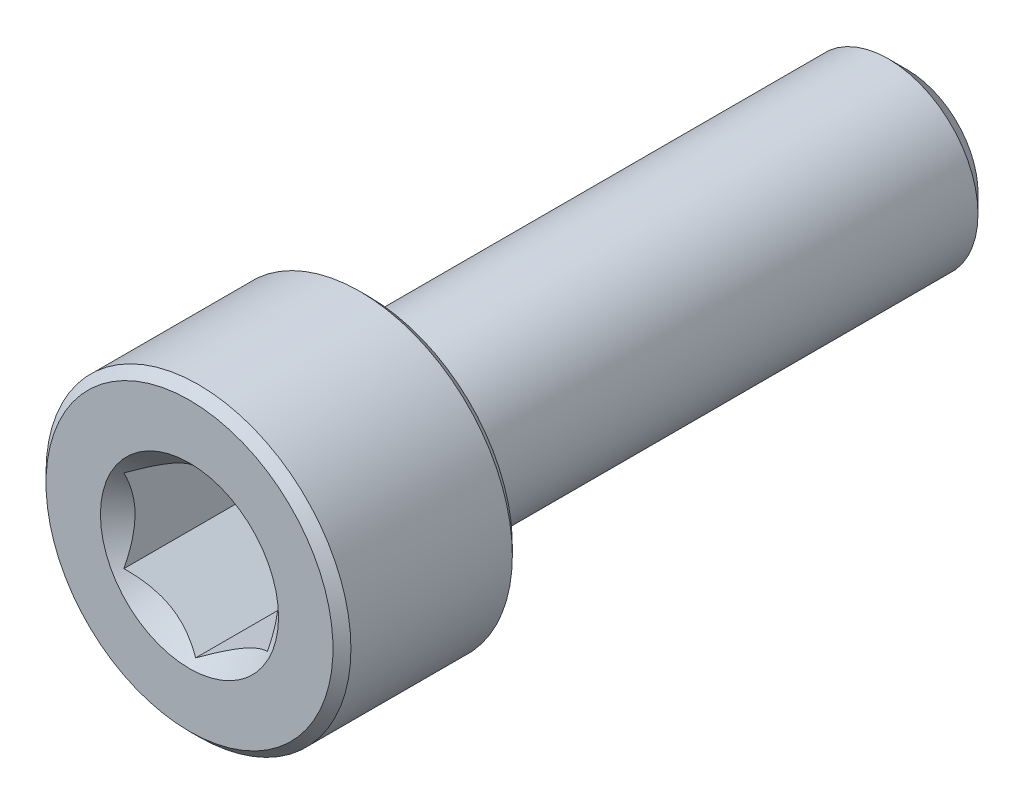
from build123d import *

# Parameters (mm, degrees)
CUT_EXTRUDE1_DEPTH = 4


with BuildPart() as part:
    # Sketch2 → Revolve1 (revolve)
    with BuildSketch(Plane(origin=(0, 0, 0), x_dir=(0, 0, -1), z_dir=(1, 0, 0))):
        with BuildLine():
            Line((-10, 0), (-10, 4))
            Line((-10, 4), (-9.75, 4.25))
            Line((-9.75, 4.25), (-5.25, 4.25))
            Line((-5.25, 4.25), (-5, 4))
            Line((-5, 4), (-5, 2.75))
            ThreePointArc((-5, 2.75), (-4.926776695, 2.573223305), (-4.75, 2.5))
            Line((-4.75, 2.5), (9.480384758, 2.5))
            Line((9.480384758, 2.5), (10, 1.980384758))
            Line((10, 1.980384758), (10, 0))
            Line((10, 0), (-10, 0))
        make_face()
    revolve(axis=Axis((0, 0, -10), (0, 0, 1)))

    # Sketch3 → Cut-Extrude1 (cut)
    with BuildSketch(Plane.XY.offset(10)):
        Polygon((2, -1.154700538), (2, 1.154700538), (0, 2.309401077), (-2, 1.154700538), (-2, -1.154700538), (0, -2.309401077), align=None)
    extrude(amount=-CUT_EXTRUDE1_DEPTH, mode=Mode.SUBTRACT)

    # Cut-Extrude2 cone 1 section (through the dimple's axis) → Cut-Extrude2 (revolve, cut)
    with BuildSketch(Plane(origin=(0, 0, 10), x_dir=(0, -1, 0), z_dir=(1, 0, 0))):
        Polygon((0, 0), (2.482606158, 0), (0, 2.482606158), align=None)
    revolve(axis=Axis((0, 0, 10), (0, 0, -1)), mode=Mode.SUBTRACT)


solid = part.part
